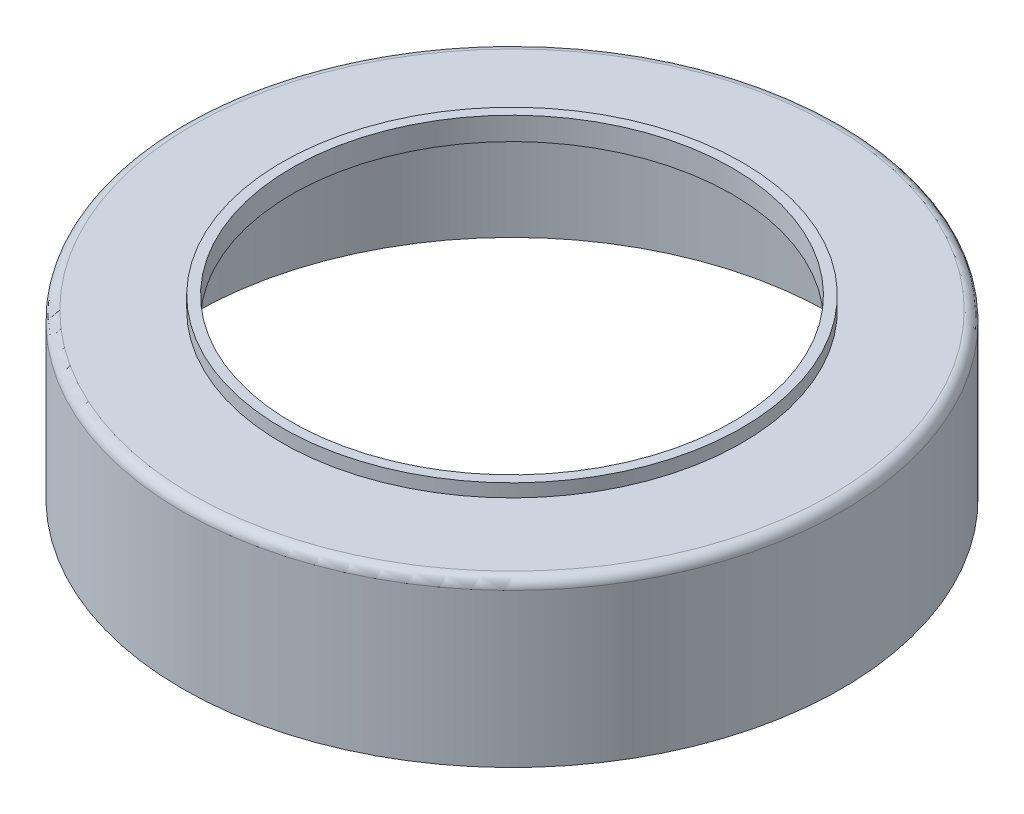
from build123d import *


with BuildPart() as part:
    # Sketch6 → Revolve1 (revolve)
    with BuildSketch(Plane.XY, mode=Mode.PRIVATE) as revolve1_sk:
        with BuildLine():
            Line((337.5, 165), (337.5, 200))
            Line((337.5, 200), (352.5, 200))
            Line((352.5, 200), (352.5, 180))
            Line((352.5, 180), (490, 180))
            ThreePointArc((490, 180), (500.606601718, 175.606601718), (505, 165))
            Line((505, 165), (505, 0))
            Line((505, 0), (505, -70))
            Line((505, -70), (490, -70))
            Line((490, -70), (490, 0))
            Line((490, 0), (490, 165))
            Line((490, 165), (337.5, 165))
        make_face()
    revolve(revolve1_sk.sketch.rotate(Axis((0, 0, 0), (0, 1, 0)), 90), axis=Axis((0, 0, 0), (0, 1, 0)))


solid = part.part
